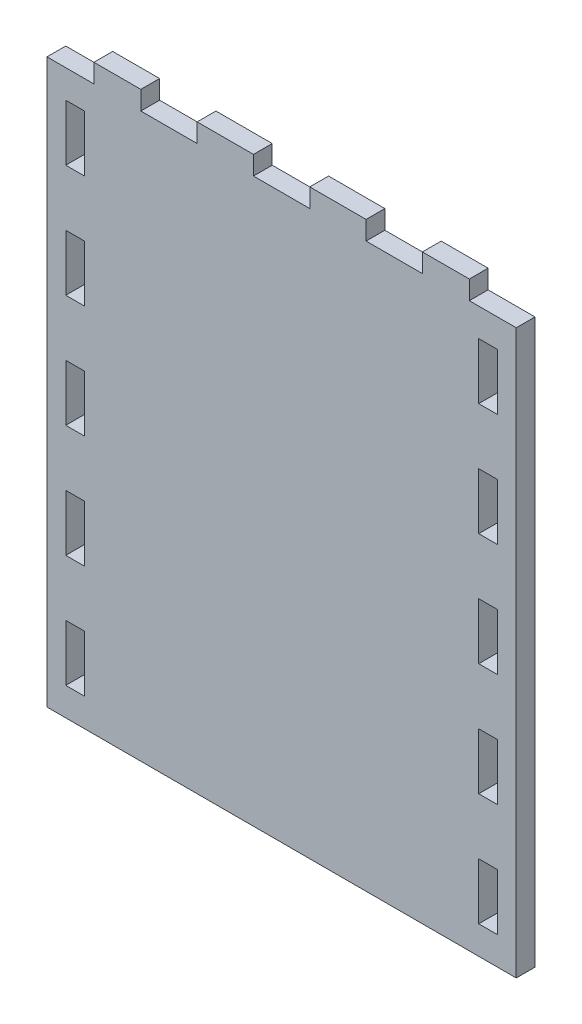
from build123d import *

# Parameters (mm, degrees)
ESQUISSE1_W             = 125
ESQUISSE1_H             = 155
BOSS_EXTRU_2_DEPTH      = 5
ESQUISSE3_W             = 5
ESQUISSE3_H             = 15
ENL_V_MAT_EXTRU_1_DEPTH = 5
ESQUISSE4_W             = 15
ESQUISSE4_H             = 5
ESQUISSE4_W_2           = 12.5
ENL_V_MAT_EXTRU_2_DEPTH = 50


with BuildPart() as part:
    # Esquisse1 → Boss.-Extru.2 (new body)
    with BuildSketch(Plane.XY):
        with Locations((8.848314607, 6.994382022)):
            Rectangle(ESQUISSE1_W, ESQUISSE1_H)
    extrude(amount=BOSS_EXTRU_2_DEPTH)

    # Esquisse3 → Enlèv. mat.-Extru.1 (cut)
    with BuildSketch(Plane(origin=(0, 0, 0), x_dir=(-1, 0, 0), z_dir=(0, 0, -1))):
        with Locations((-63.848314607, -55.505617978)):
            Rectangle(ESQUISSE3_W, ESQUISSE3_H)
        with Locations((-63.848314607, -25.505617978)):
            Rectangle(ESQUISSE3_W, ESQUISSE3_H)
        with Locations((-63.848314607, 4.494382022)):
            Rectangle(ESQUISSE3_W, ESQUISSE3_H)
        with Locations((-63.848314607, 34.494382022)):
            Rectangle(ESQUISSE3_W, ESQUISSE3_H)
        with Locations((-63.848314607, 64.494382022)):
            Rectangle(ESQUISSE3_W, ESQUISSE3_H)
        with Locations((46.151685393, -55.505617978)):
            Rectangle(ESQUISSE3_W, ESQUISSE3_H)
        with Locations((46.151685393, 34.494382022)):
            Rectangle(ESQUISSE3_W, ESQUISSE3_H)
        with Locations((46.151685393, -25.505617978)):
            Rectangle(ESQUISSE3_W, ESQUISSE3_H)
        with Locations((46.151685393, 4.494382022)):
            Rectangle(ESQUISSE3_W, ESQUISSE3_H)
        with Locations((46.151685393, 64.494382022)):
            Rectangle(ESQUISSE3_W, ESQUISSE3_H)
    extrude(amount=-ENL_V_MAT_EXTRU_1_DEPTH, mode=Mode.SUBTRACT)

    # Esquisse4 → Enlèv. mat.-Extru.2 (cut)
    with BuildSketch(Plane(origin=(0, 0, 0), x_dir=(-1, 0, 0), z_dir=(0, 0, -1))):
        with Locations((-38.848314607, 81.994382022)):
            Rectangle(ESQUISSE4_W, ESQUISSE4_H)
        with Locations((-65.098314607, 81.994382022)):
            Rectangle(ESQUISSE4_W_2, ESQUISSE4_H)
        with Locations((-8.848314607, 81.994382022)):
            Rectangle(ESQUISSE4_W, ESQUISSE4_H)
        with Locations((21.151685393, 81.994382022)):
            Rectangle(ESQUISSE4_W, ESQUISSE4_H)
        with Locations((47.401685393, 81.994382022)):
            Rectangle(ESQUISSE4_W_2, ESQUISSE4_H)
    extrude(amount=-ENL_V_MAT_EXTRU_2_DEPTH, mode=Mode.SUBTRACT)


solid = part.part
